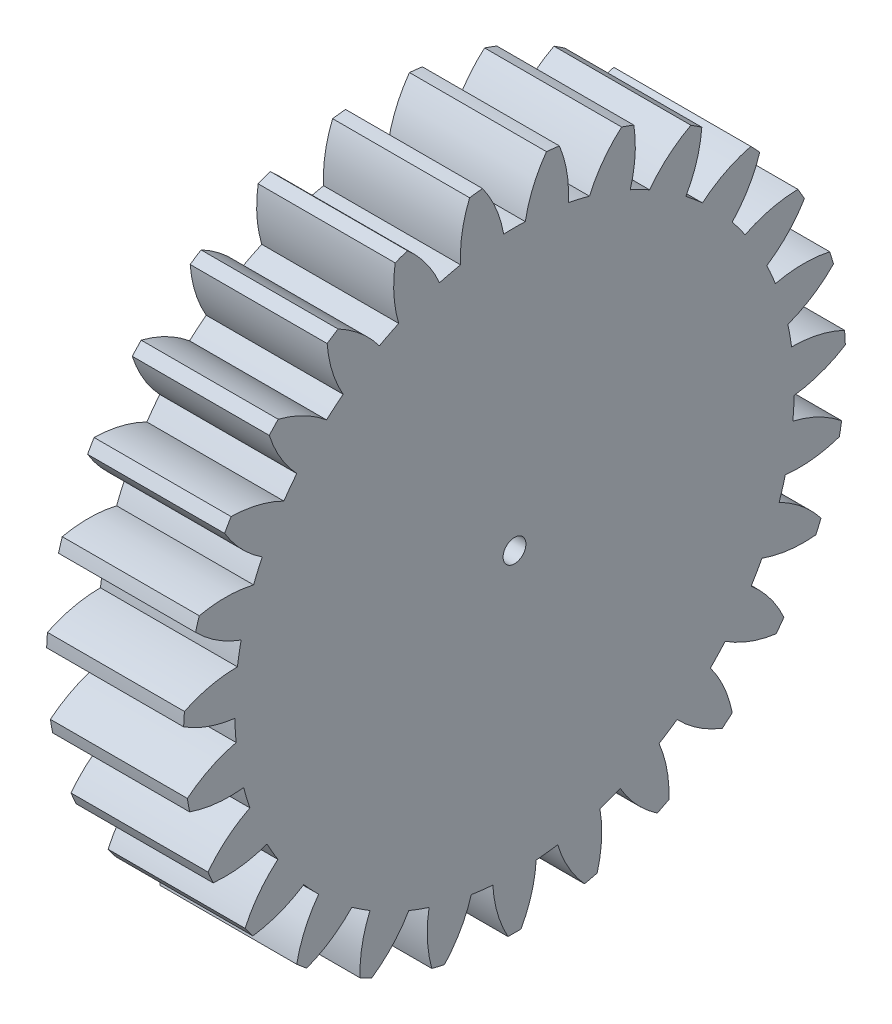
from build123d import *

# Parameters (mm, degrees)
BASPROSKE_W     = 6
BASPROSKE_H     = 14.5
TOOTHCUT_DEPTH  = 22.365860619
TEETHCUTS_COUNT = 27
TEETHCUTS_ANGLE = 346.666666667
BORSKE_R        = 0.5
BORE_DEPTH      = 50.0000508


with BuildPart() as part:
    # BasProSke → Base-Revolve (revolve)
    with BuildSketch(Plane(origin=(0, 0, 0), x_dir=(1, 0, 0), z_dir=(0, 1, 0)), mode=Mode.PRIVATE) as base_revolve_sk:
        with Locations((3, 7.25)):
            Rectangle(BASPROSKE_W, BASPROSKE_H)
    revolve(base_revolve_sk.sketch.rotate(Axis((-10, 0, 0), (1, 0, 0)), 180), axis=Axis((-10, 0, 0), (1, 0, 0)))

    # TooCutSke → ToothCut (cut, through all)
    with BuildSketch(Plane(origin=(0, 0, 0), x_dir=(0, 0, -1), z_dir=(1, 0, 0))):
        with BuildLine():
            ThreePointArc((0.474054864, 12.239823242), (0, 12.249), (-0.474054864, 12.239823242))
            ThreePointArc((-0.474054864, 12.239823242), (-0.820231692, 13.40120918), (-1.416685779, 14.456149092))
            ThreePointArc((-1.416685779, 14.456149092), (0, 14.5254), (1.416685779, 14.456149092))
            ThreePointArc((1.416685779, 14.456149092), (0.820231692, 13.40120918), (0.474054864, 12.239823242))
        make_face()
    toothcut = extrude(amount=TOOTHCUT_DEPTH, mode=Mode.SUBTRACT)

    # TeethCuts: ToothCut ×27 about axis
    teethcuts_axis = Axis((-10, 0, 0), (1, 0, 0))
    for i in range(1, TEETHCUTS_COUNT):
        add(toothcut.rotate(teethcuts_axis, i * TEETHCUTS_ANGLE / (TEETHCUTS_COUNT - 1)), mode=Mode.SUBTRACT)

    # BorSke → Bore (cut, symmetric)
    with BuildSketch(Plane(origin=(0, 0, 0), x_dir=(0, 0, -1), z_dir=(1, 0, 0))):
        with Locations(Location((0, 0, 0), (0, 0, 180))):
            Circle(BORSKE_R)
    extrude(amount=BORE_DEPTH, both=True, mode=Mode.SUBTRACT)


solid = part.part
